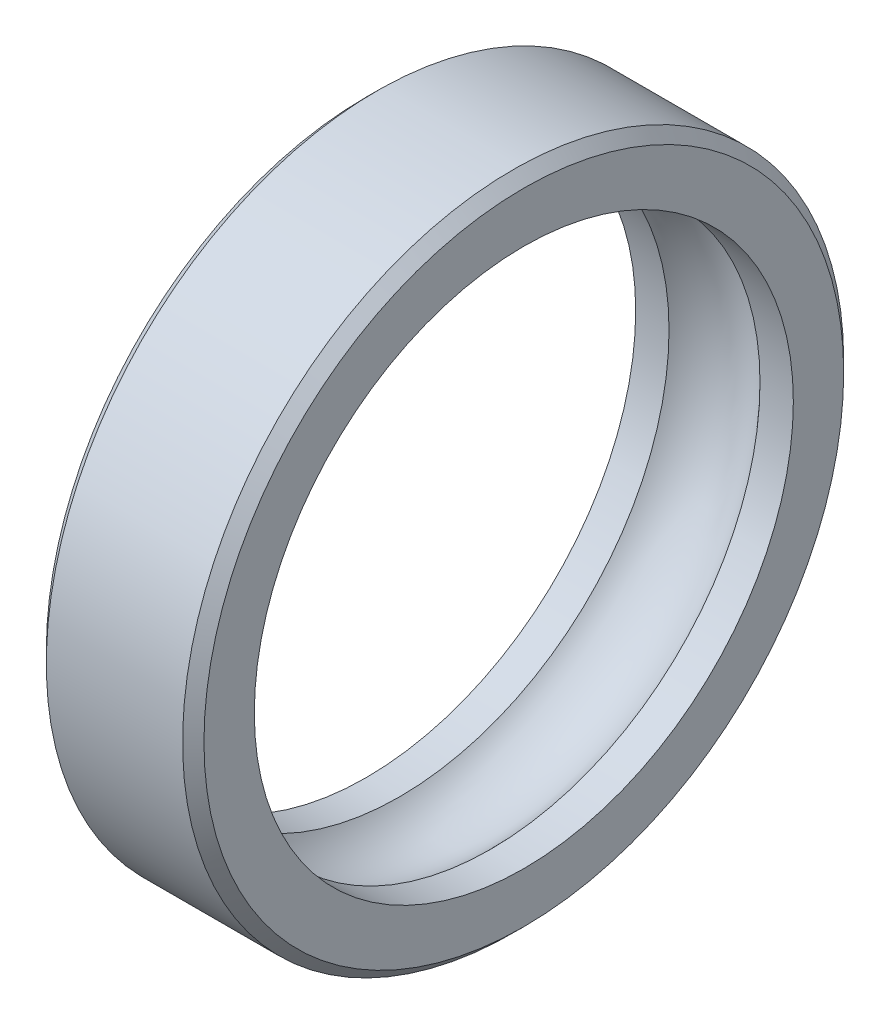
from build123d import *

# Parameters (mm, degrees)
CHAMFER1_SIZE = 2.1


with BuildPart() as part:
    # Sketch1 → Revolve1 (revolve)
    with BuildSketch(Plane.XY, mode=Mode.PRIVATE) as revolve1_sk:
        with BuildLine():
            Line((-8.94427191, 53), (-15.5, 53))
            Line((-15.5, 53), (-15.5, 65))
            Line((-15.5, 65), (15.5, 65))
            Line((15.5, 65), (15.5, 53))
            Line((15.5, 53), (8.94427191, 53))
            ThreePointArc((8.94427191, 53), (0, 57), (-8.94427191, 53))
        make_face()
    revolve(revolve1_sk.sketch.rotate(Axis((-76.633235581, 0, 0), (1, 0, 0)), 90), axis=Axis((-76.633235581, 0, 0), (1, 0, 0)))

    # Chamfer1
    chamfer1_edges = [part.edges().sort_by_distance(p)[0] for p in [
        (15.5, 0, -65),
        (-15.5, 0, -65),
    ]]
    chamfer(chamfer1_edges, length=CHAMFER1_SIZE)


solid = part.part
